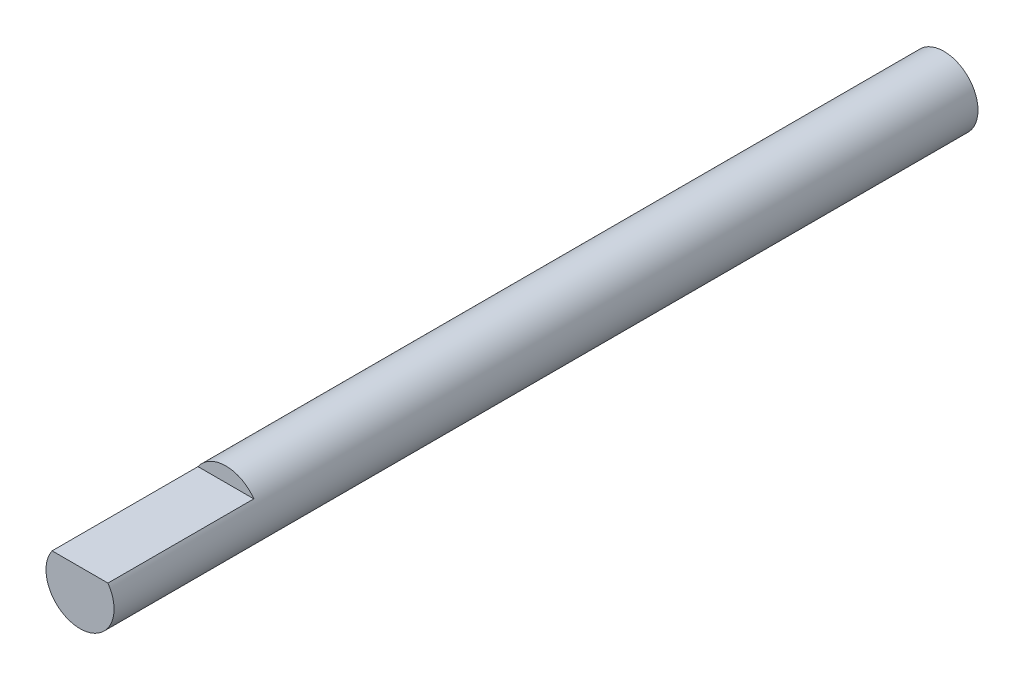
from build123d import *

# Parameters (mm, degrees)
SZKIC1_R                    = 7
DODANIE_WYCI_GNI_CIE1_DEPTH = 177.7
SZKIC2_W                    = 14
SZKIC2_H                    = 6
WYTNIJ_WYCI_GNI_CIE1_DEPTH  = 30


with BuildPart() as part:
    # Szkic1 → Dodanie-wyciągnięcie1 (new body)
    with BuildSketch(Plane.XY):
        Circle(SZKIC1_R)
    extrude(amount=DODANIE_WYCI_GNI_CIE1_DEPTH)

    # Szkic2 → Wytnij-wyciągnięcie1 (cut)
    with BuildSketch(Plane.XY.offset(177.7)):
        with Locations((0, 7)):
            Rectangle(SZKIC2_W, SZKIC2_H)
    extrude(amount=-WYTNIJ_WYCI_GNI_CIE1_DEPTH, mode=Mode.SUBTRACT)


solid = part.part
